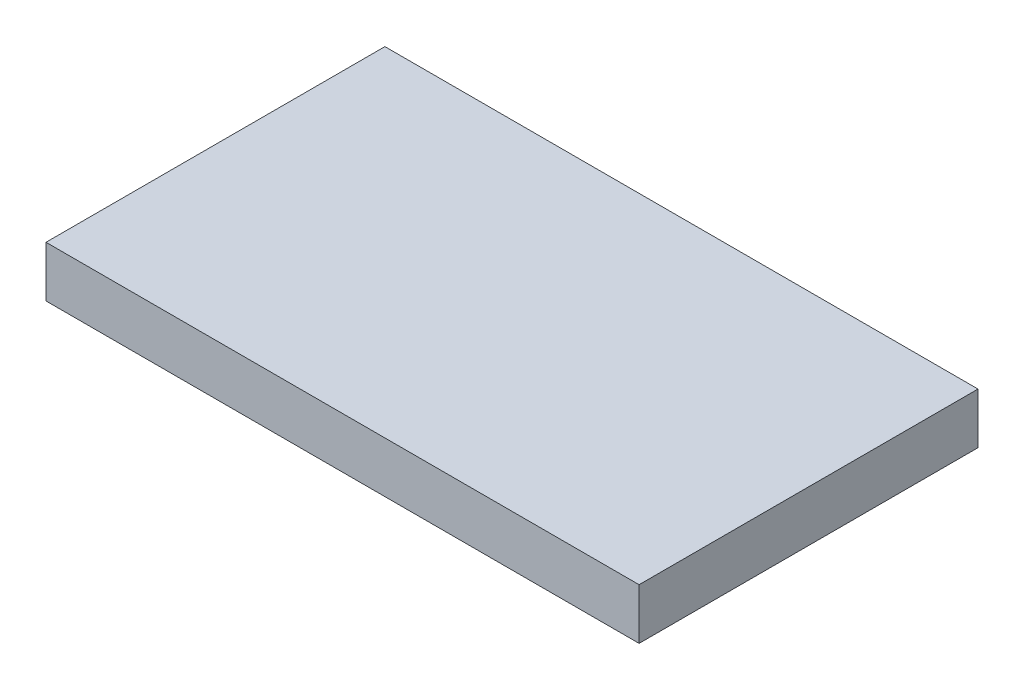
from build123d import *

# Parameters (mm, degrees)
SKETCH1_W           = 17.5
SKETCH1_H           = 10
BOSS_EXTRUDE1_DEPTH = 1.5


with BuildPart() as part:
    # Sketch1 → Boss-Extrude1 (new body)
    with BuildSketch(Plane(origin=(0, 0, 0), x_dir=(1, 0, 0), z_dir=(0, 1, 0))):
        Rectangle(SKETCH1_W, SKETCH1_H)
    extrude(amount=BOSS_EXTRUDE1_DEPTH)


solid = part.part
